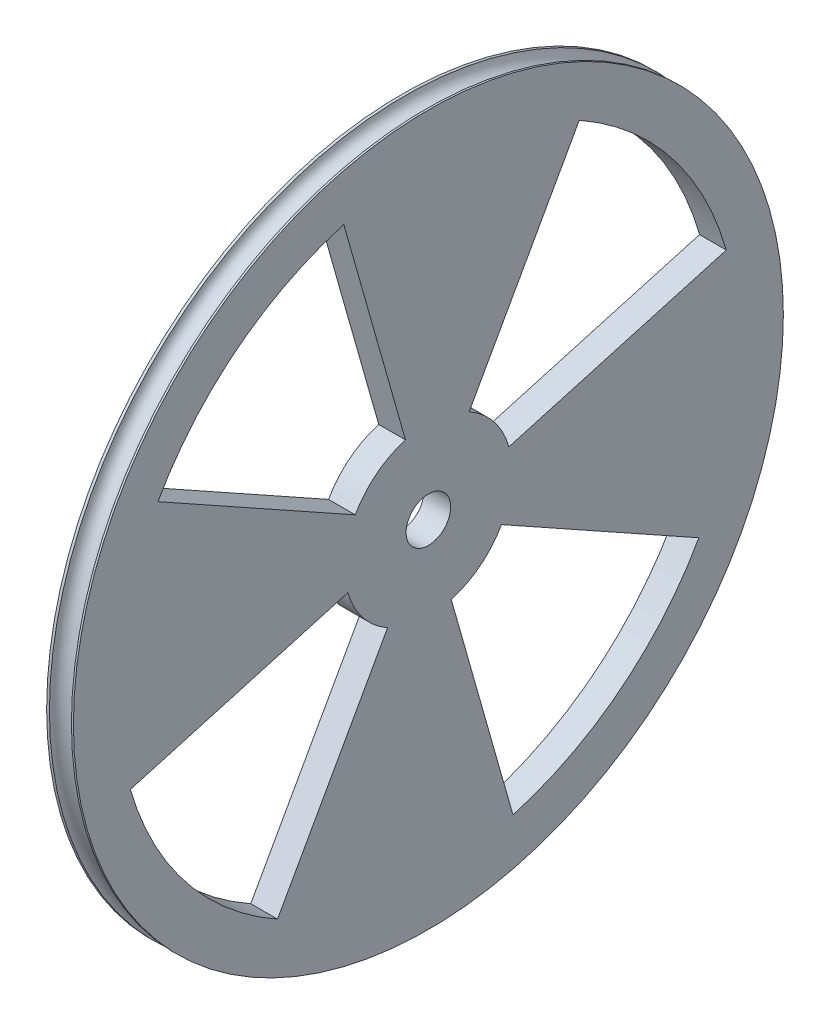
from build123d import *

# Parameters (mm, degrees)
SKETCH2_R          = 3.175
CUT_EXTRUDE1_DEPTH = 72.584302274


with BuildPart() as part:
    # Sketch1 → Revolve1 (revolve)
    with BuildSketch(Plane.XY, mode=Mode.PRIVATE) as revolve1_sk:
        with BuildLine():
            Line((0, 0), (3.81, 0))
            Line((3.81, 0), (3.81, 50.546))
            Line((3.81, 50.546), (3.530377137, 50.546))
            ThreePointArc((3.530377137, 50.546), (1.963328877, 49.2125), (0.396280616, 50.546))
            Line((0.396280616, 50.546), (0, 50.546))
            Line((0, 50.546), (0, 0))
        make_face()
    revolve(revolve1_sk.sketch.rotate(Axis((0, 0, 0), (1, 0, 0)), 90), axis=Axis((0, 0, 0), (1, 0, 0)))

    # Sketch2 → Cut-Extrude1 (cut, through all)
    with BuildSketch(Plane(origin=(3.81, 0, 0), x_dir=(0, 0, -1), z_dir=(1, 0, 0))):
        with BuildLine():
            Line((-38.511581654, 21.479742361), (-10.413064573, 5.807861807))
            ThreePointArc((-10.413064573, 5.807861807), (-7.397844739, 9.350671943), (-3.256370105, 11.46992704))
            Line((-3.256370105, 11.46992704), (-12.04332906, 42.420272023))
            ThreePointArc((-12.04332906, 42.420272023), (-27.360120522, 34.582438584), (-38.511581654, 21.479742361))
        make_face()
        with BuildLine():
            Line((21.479742361, 38.511581654), (5.807861807, 10.413064573))
            ThreePointArc((5.807861807, 10.413064573), (9.350671943, 7.397844739), (11.46992704, 3.256370105))
            Line((11.46992704, 3.256370105), (42.420272023, 12.04332906))
            ThreePointArc((42.420272023, 12.04332906), (34.582438584, 27.360120522), (21.479742361, 38.511581654))
        make_face()
        with BuildLine():
            Line((38.511581654, -21.479742361), (10.413064573, -5.807861807))
            ThreePointArc((10.413064573, -5.807861807), (7.397844739, -9.350671943), (3.256370105, -11.46992704))
            Line((3.256370105, -11.46992704), (12.04332906, -42.420272023))
            ThreePointArc((12.04332906, -42.420272023), (27.360120522, -34.582438584), (38.511581654, -21.479742361))
        make_face()
        with BuildLine():
            Line((-21.479742361, -38.511581654), (-5.807861807, -10.413064573))
            ThreePointArc((-5.807861807, -10.413064573), (-9.350671943, -7.397844739), (-11.46992704, -3.256370105))
            Line((-11.46992704, -3.256370105), (-42.420272023, -12.04332906))
            ThreePointArc((-42.420272023, -12.04332906), (-34.582438584, -27.360120522), (-21.479742361, -38.511581654))
        make_face()
        Circle(SKETCH2_R)
    extrude(amount=-CUT_EXTRUDE1_DEPTH, mode=Mode.SUBTRACT)


solid = part.part
